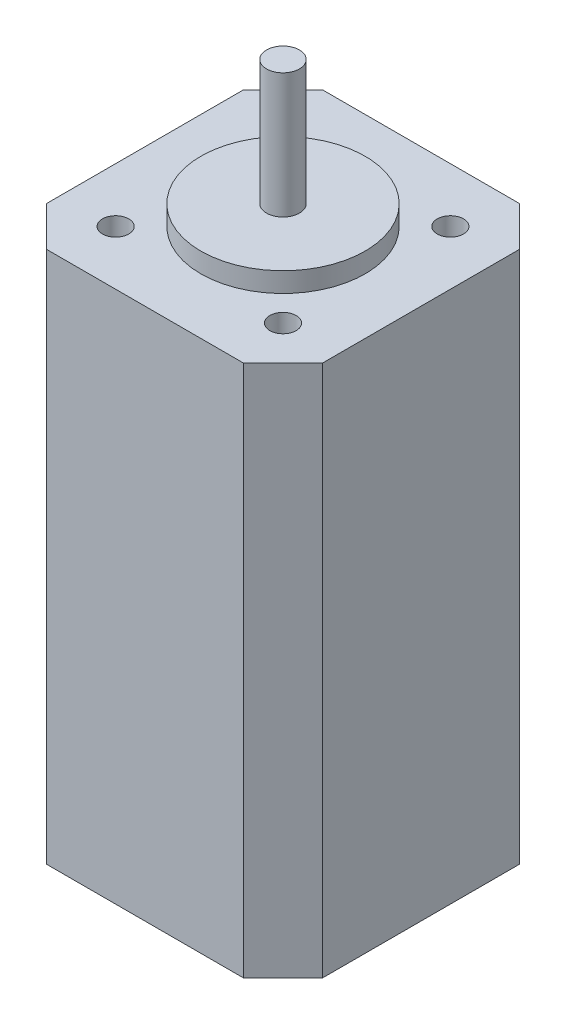
from build123d import *

# Parameters (mm, degrees)
SZKIC1_R                    = 2
DODANIE_WYCI_GNI_CIE1_DEPTH = 81
DODANIE_WYCI_GNI_CIE2_DEPTH = 3
SZKIC3_R                    = 2.5
DODANIE_WYCI_GNI_CIE3_DEPTH = 19


with BuildPart() as part:
    # Szkic1 → Dodanie-wyciągnięcie1 (new body)
    with BuildSketch(Plane(origin=(0, 0, 0), x_dir=(1, 0, 0), z_dir=(0, 1, 0))):
        Polygon((6, 0), (36, 0), (42, 6), (42, 36), (36, 42), (6, 42), (0, 36), (0, 6), align=None)
        with Locations(Location((33.727922061, 33.727922061, 0), (0, 0, 270))):
            Circle(SZKIC1_R, mode=Mode.SUBTRACT)
        with Locations(Location((33.727922061, 8.272077939, 0), (0, 0, 270))):
            Circle(SZKIC1_R, mode=Mode.SUBTRACT)
        with Locations(Location((8.272077939, 8.272077939, 0), (0, 0, 270))):
            Circle(SZKIC1_R, mode=Mode.SUBTRACT)
        with Locations(Location((8.272077939, 33.727922061, 0), (0, 0, 270))):
            Circle(SZKIC1_R, mode=Mode.SUBTRACT)
    extrude(amount=DODANIE_WYCI_GNI_CIE1_DEPTH)

    # Szkic2 → Dodanie-wyciągnięcie2 (add)
    with BuildSketch(Plane(origin=(0, 81, 0), x_dir=(1, 0, 0), z_dir=(0, 1, 0))):
        with BuildLine():
            ThreePointArc((33.5, 21), (29.838834765, 29.838834765), (21, 33.5))
            Line((21, 33.5), (21, 21))
            Line((21, 21), (33.5, 21))
        make_face()
        with BuildLine():
            Line((21, 21), (21, 33.5))
            ThreePointArc((21, 33.5), (12.161165235, 12.161165235), (33.5, 21))
            Line((33.5, 21), (21, 21))
        make_face()
    extrude(amount=DODANIE_WYCI_GNI_CIE2_DEPTH)

    # Szkic3 → Dodanie-wyciągnięcie3 (add)
    with BuildSketch(Plane(origin=(0, 84, 0), x_dir=(1, 0, 0), z_dir=(0, 1, 0))):
        with Locations(Location((21, 21, 0), (0, 0, 270))):
            Circle(SZKIC3_R)
    extrude(amount=DODANIE_WYCI_GNI_CIE3_DEPTH)


solid = part.part
